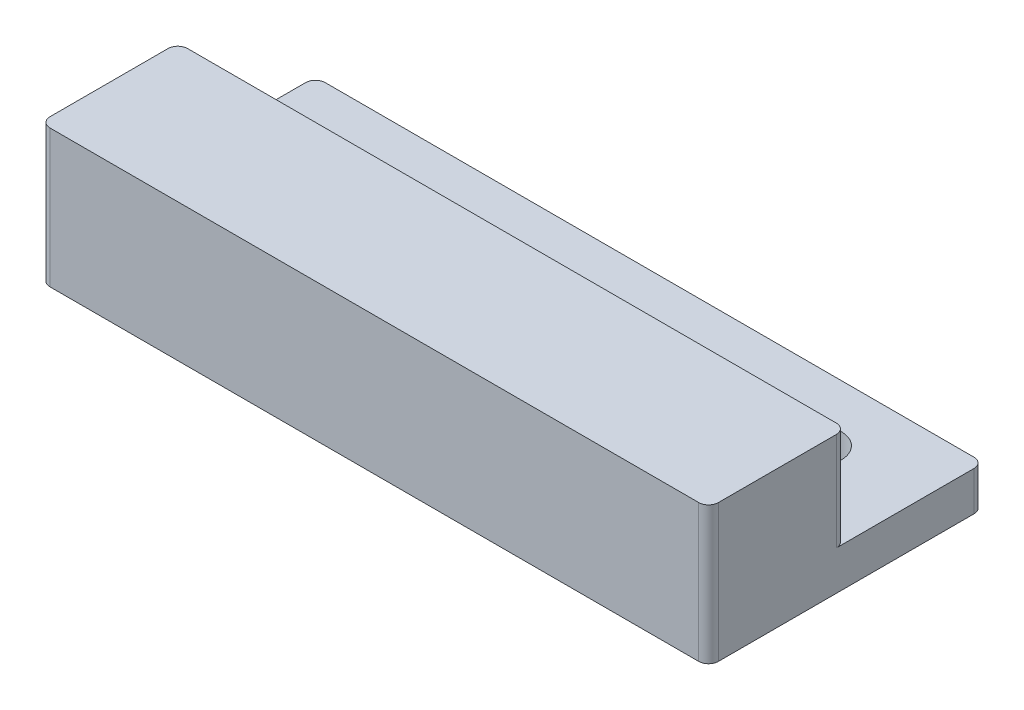
from build123d import *

# Parameters (mm, degrees)
SKETCH1_W           = 34
SKETCH1_H           = 14
BOSS_EXTRUDE1_DEPTH = 2
SKETCH2_W           = 34
SKETCH2_H           = 7
BOSS_EXTRUDE2_DEPTH = 5
FILLET1_R           = 0.5
CUT_EXTRUDE1_REACH  = 21.053
SKETCH3_R           = 1.25


with BuildPart() as part:
    # Sketch1 → Boss-Extrude1 (new body)
    with BuildSketch(Plane(origin=(0, 0, 0), x_dir=(1, 0, 0), z_dir=(0, 1, 0))):
        Rectangle(SKETCH1_W, SKETCH1_H)
    extrude(amount=BOSS_EXTRUDE1_DEPTH)

    # Sketch2 → Boss-Extrude2 (add)
    with BuildSketch(Plane(origin=(0, 2, 0), x_dir=(1, 0, 0), z_dir=(0, 1, 0))):
        with Locations((0, -3.5)):
            Rectangle(SKETCH2_W, SKETCH2_H)
    extrude(amount=BOSS_EXTRUDE2_DEPTH)

    # Fillet1
    fillet1_edges = [part.edges().sort_by_distance(p)[0] for p in [
        (17, 4.5, 0),
        (-17, 4.5, 0),
        (17, 3.5, 7),
        (-17, 3.5, 7),
        (-17, 1, -7),
        (17, 1, -7),
    ]]
    fillet(fillet1_edges, radius=FILLET1_R)

    # Sketch3 → Cut-Extrude1 (cut, up to next)
    with BuildSketch(Plane(origin=(0, 2, 0), x_dir=(1, 0, 0), z_dir=(0, 1, 0)), mode=Mode.PRIVATE) as cut_extrude1_sk1:
        with Locations(Location((12, 3.5, 0), (0, 0, 270))):
            Circle(SKETCH3_R)
    cut_extrude1_tool1 = extrude(cut_extrude1_sk1.sketch, amount=-CUT_EXTRUDE1_REACH, mode=Mode.PRIVATE) & part.part
    # Sketch3 → Cut-Extrude1 (cut, up to next)
    with BuildSketch(Plane(origin=(0, 2, 0), x_dir=(1, 0, 0), z_dir=(0, 1, 0)), mode=Mode.PRIVATE) as cut_extrude1_sk2:
        with Locations(Location((-12, 3.5, 0), (0, 0, 270))):
            Circle(SKETCH3_R)
    cut_extrude1_tool2 = extrude(cut_extrude1_sk2.sketch, amount=-CUT_EXTRUDE1_REACH, mode=Mode.PRIVATE) & part.part
    add(cut_extrude1_tool1.solids().sort_by_distance((12, 2, -3.5))[0], mode=Mode.SUBTRACT)
    add(cut_extrude1_tool2.solids().sort_by_distance((-12, 2, -3.5))[0], mode=Mode.SUBTRACT)


solid = part.part
